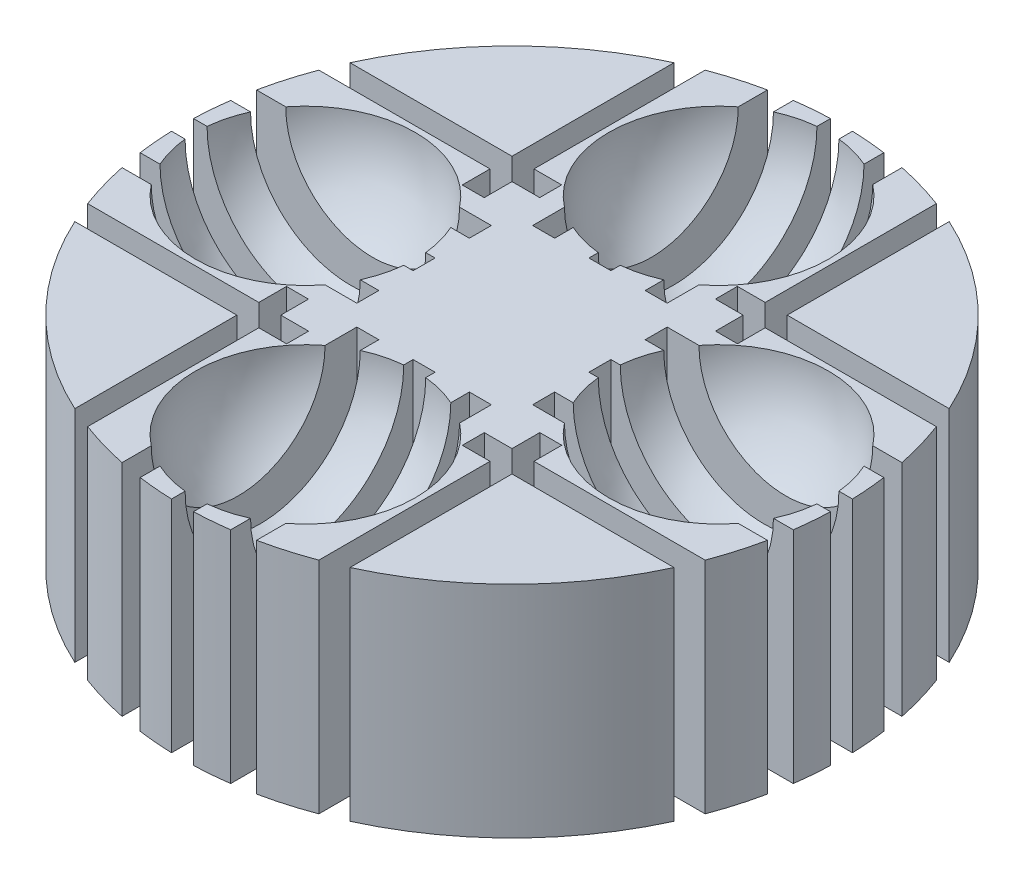
from build123d import *

# Parameters (mm, degrees)
SKETCH1_R           = 95.25
BOSS_EXTRUDE1_DEPTH = 63.5
SKETCH7_W           = 6.35
SKETCH7_H           = 101.6
SKETCH7_H_2         = 100.875432805
CUT_EXTRUDE1_DEPTH  = 149.920700374
CIRPATTERN1_COUNT   = 4


with BuildPart() as part:
    # Sketch1 → Boss-Extrude1 (new body)
    with BuildSketch(Plane(origin=(0, 0, 0), x_dir=(1, 0, 0), z_dir=(0, 1, 0))):
        with Locations(Location((0, 0, 0), (0, 0, 270))):
            Circle(SKETCH1_R)
    extrude(amount=-BOSS_EXTRUDE1_DEPTH)

    # Sketch3 → Cut-Revolve3 (revolve, cut)
    with BuildSketch(Plane.XY.offset(59.69)):
        with BuildLine():
            Line((0, 0), (0, -31.75))
            ThreePointArc((0, -31.75), (22.450640303, -22.450640303), (31.75, 0))
            Line((31.75, 0), (0, 0))
        make_face()
    cut_revolve3 = revolve(axis=Axis((0, 0, 59.69), (0, -1, 0)), mode=Mode.SUBTRACT)

    # Sketch7 → Cut-Extrude1 (cut, through all)
    with BuildSketch(Plane(origin=(0, 0, 0), x_dir=(1, 0, 0), z_dir=(0, 1, 0))):
        with Locations((-16.256, -76.2)):
            Rectangle(SKETCH7_W, SKETCH7_H)
        with Locations((0, -76.2)):
            Rectangle(SKETCH7_W, SKETCH7_H)
        with Locations((16.256, -75.837716403)):
            Rectangle(SKETCH7_W, SKETCH7_H_2)
        with Locations((36.576, -76.171178844)):
            Rectangle(SKETCH7_W, SKETCH7_H)
        with Locations((-36.576, -76.2)):
            Rectangle(SKETCH7_W, SKETCH7_H)
    cut_extrude1 = extrude(amount=-CUT_EXTRUDE1_DEPTH, mode=Mode.SUBTRACT)

    # CirPattern1: Cut-Revolve3, Cut-Extrude1 ×4 about axis
    cirpattern1_axis = Axis((0, 0, 0), (0, 1, 0))
    add([cut_revolve3.rotate(cirpattern1_axis, i * 360 / CIRPATTERN1_COUNT) for i in range(1, CIRPATTERN1_COUNT)], mode=Mode.SUBTRACT)
    add([cut_extrude1.rotate(cirpattern1_axis, i * 360 / CIRPATTERN1_COUNT) for i in range(1, CIRPATTERN1_COUNT)], mode=Mode.SUBTRACT)


solid = part.part
